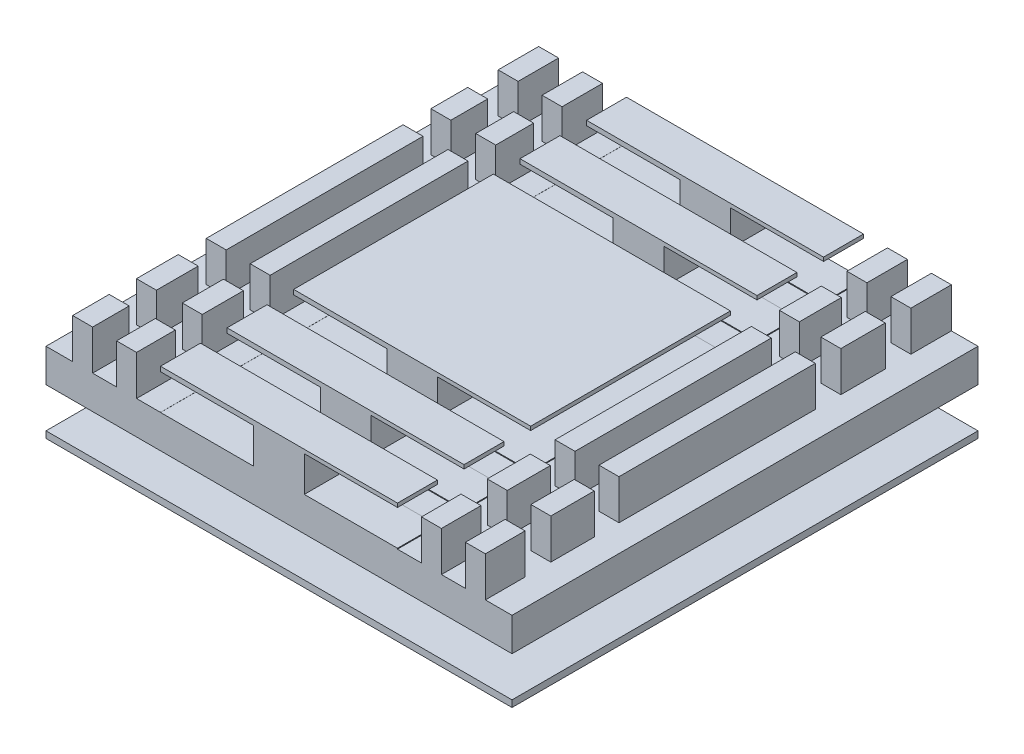
from build123d import *

# Parameters (mm, degrees)
SKETCH1_W           = 35
SKETCH1_H           = 35
BOSS_EXTRUDE1_DEPTH = 9
SKETCH2_W           = 2
SKETCH2_H           = 35
SKETCH2_W_2         = 1.8
CUT_EXTRUDE1_DEPTH  = 3
SKETCH3_W           = 35
SKETCH3_H           = 3
CUT_EXTRUDE2_DEPTH  = 3
SKETCH4_W           = 7
SKETCH4_H           = 2.65
CUT_EXTRUDE3_DEPTH  = 51.309044912
SKETCH5_W           = 32
SKETCH5_H           = 3
CUT_EXTRUDE4_DEPTH  = 3
SKETCH6_W           = 17.8
SKETCH6_H           = 2
CUT_EXTRUDE5_DEPTH  = 3
SKETCH7_W           = 1.5
SKETCH7_H           = 2.079992284
SKETCH7_H_2         = 2.089639239
SKETCH7_H_3         = 2.130315237
SKETCH7_H_4         = 2.284421
SKETCH7_H_5         = 1.923722947
SKETCH7_H_6         = 2.10231694
SKETCH7_H_7         = 1.921766709
CUT_EXTRUDE6_DEPTH  = 3
SKETCH8_W           = 1.5
SKETCH8_H           = 1.855781426
SKETCH8_H_2         = 1.933933062
SKETCH8_H_3         = 1.973134408
SKETCH8_H_4         = 2.021952678
SKETCH8_H_5         = 2.006089453
SKETCH8_H_6         = 2.101240168
SKETCH8_H_7         = 2.045740356
CUT_EXTRUDE7_DEPTH  = 3
SKETCH9_W           = 32
SKETCH9_H           = 3
CUT_EXTRUDE9_DEPTH  = 3
SKETCH11_W          = 29
SKETCH11_H          = 3
CUT_EXTRUDE10_DEPTH = 3


with BuildPart() as part:
    # Sketch1 → Boss-Extrude1 (new body)
    with BuildSketch(Plane(origin=(0, 0, 0), x_dir=(1, 0, 0), z_dir=(0, 1, 0))):
        with Locations((17.5, 17.5)):
            Rectangle(SKETCH1_W, SKETCH1_H)
    extrude(amount=BOSS_EXTRUDE1_DEPTH)

    # Sketch2 → Cut-Extrude1 (cut)
    with BuildSketch(Plane(origin=(0, 9, 0), x_dir=(1, 0, 0), z_dir=(0, 1, 0))):
        with Locations((34, 17.5)):
            Rectangle(SKETCH2_W, SKETCH2_H)
        with Locations((30.6, 17.5)):
            Rectangle(SKETCH2_W_2, SKETCH2_H)
        with Locations((27.3, 17.5)):
            Rectangle(SKETCH2_W_2, SKETCH2_H)
        with Locations((1, 17.5)):
            Rectangle(SKETCH2_W, SKETCH2_H)
        with Locations((4.4, 17.5)):
            Rectangle(SKETCH2_W_2, SKETCH2_H)
        with Locations((7.7, 17.5)):
            Rectangle(SKETCH2_W_2, SKETCH2_H)
    extrude(amount=-CUT_EXTRUDE1_DEPTH, mode=Mode.SUBTRACT)

    # Sketch3 → Cut-Extrude2 (cut)
    with BuildSketch(Plane(origin=(35, 0, 0), x_dir=(0, 0, -1), z_dir=(1, 0, 0))):
        with Locations((17.5, 2)):
            Rectangle(SKETCH3_W, SKETCH3_H)
    extrude(amount=-CUT_EXTRUDE2_DEPTH, mode=Mode.SUBTRACT)

    # Sketch4 → Cut-Extrude3 (cut, through all)
    with BuildSketch(Plane.XY):
        with Locations((22.9, 7.387674937)):
            Rectangle(SKETCH4_W, SKETCH4_H)
        with Locations((12.1, 7.318212489)):
            Rectangle(SKETCH4_W, SKETCH4_H)
    extrude(amount=-CUT_EXTRUDE3_DEPTH, mode=Mode.SUBTRACT)

    # Sketch5 → Cut-Extrude4 (cut)
    with BuildSketch(Plane.XY):
        with Locations((16, 2)):
            Rectangle(SKETCH5_W, SKETCH5_H)
    extrude(amount=-CUT_EXTRUDE4_DEPTH, mode=Mode.SUBTRACT)

    # Sketch6 → Cut-Extrude5 (cut)
    with BuildSketch(Plane(origin=(0, 9, 0), x_dir=(1, 0, 0), z_dir=(0, 1, 0))):
        with Locations((17.5, 4)):
            Rectangle(SKETCH6_W, SKETCH6_H)
        with Locations((17.5, 9)):
            Rectangle(SKETCH6_W, SKETCH6_H)
        with Locations((17.5, 31)):
            Rectangle(SKETCH6_W, SKETCH6_H)
        with Locations((17.5, 26)):
            Rectangle(SKETCH6_W, SKETCH6_H)
    extrude(amount=-CUT_EXTRUDE5_DEPTH, mode=Mode.SUBTRACT)

    # Sketch7 → Cut-Extrude6 (cut)
    with BuildSketch(Plane(origin=(0, 9, 0), x_dir=(1, 0, 0), z_dir=(0, 1, 0))):
        with Locations((6.05, 25.936938184)):
            Rectangle(SKETCH7_W, SKETCH7_H)
        with Locations((2.75, 25.861771744)):
            Rectangle(SKETCH7_W, SKETCH7_H_2)
        with Locations((6.05, 30.892822657)):
            Rectangle(SKETCH7_W, SKETCH7_H_3)
        with Locations((2.75, 30.815769775)):
            Rectangle(SKETCH7_W, SKETCH7_H_4)
        with Locations((28.95, 30.996118802)):
            Rectangle(SKETCH7_W, SKETCH7_H_5)
        with Locations((32.25, 30.996118802)):
            Rectangle(SKETCH7_W, SKETCH7_H_5)
        with Locations((28.95, 25.828744005)):
            Rectangle(SKETCH7_W, SKETCH7_H_6)
        with Locations((32.25, 25.738468889)):
            Rectangle(SKETCH7_W, SKETCH7_H_7)
    extrude(amount=-CUT_EXTRUDE6_DEPTH, mode=Mode.SUBTRACT)

    # Sketch8 → Cut-Extrude7 (cut)
    with BuildSketch(Plane(origin=(0, 9, 0), x_dir=(1, 0, 0), z_dir=(0, 1, 0))):
        with Locations((28.95, 9.105526505)):
            Rectangle(SKETCH8_W, SKETCH8_H)
        with Locations((32.25, 9.105526505)):
            Rectangle(SKETCH8_W, SKETCH8_H)
        with Locations((32.25, 3.949699522)):
            Rectangle(SKETCH8_W, SKETCH8_H_2)
        with Locations((28.95, 3.95623308)):
            Rectangle(SKETCH8_W, SKETCH8_H_3)
        with Locations((6.05, 3.923953213)):
            Rectangle(SKETCH8_W, SKETCH8_H_4)
        with Locations((6.05, 9.030372491)):
            Rectangle(SKETCH8_W, SKETCH8_H_5)
        with Locations((2.75, 8.982797134)):
            Rectangle(SKETCH8_W, SKETCH8_H_6)
        with Locations((2.75, 3.769333302)):
            Rectangle(SKETCH8_W, SKETCH8_H_7)
    extrude(amount=-CUT_EXTRUDE7_DEPTH, mode=Mode.SUBTRACT)

    # Sketch9 → Cut-Extrude9 (cut)
    with BuildSketch(Plane(origin=(0, 0, -35), x_dir=(-1, 0, 0), z_dir=(0, 0, -1))):
        with Locations((-16, 2)):
            Rectangle(SKETCH9_W, SKETCH9_H)
    extrude(amount=-CUT_EXTRUDE9_DEPTH, mode=Mode.SUBTRACT)

    # Sketch11 → Cut-Extrude10 (cut)
    with BuildSketch(Plane.ZY):
        with Locations((-17.5, 2)):
            Rectangle(SKETCH11_W, SKETCH11_H)
    extrude(amount=-CUT_EXTRUDE10_DEPTH, mode=Mode.SUBTRACT)


solid = part.part
